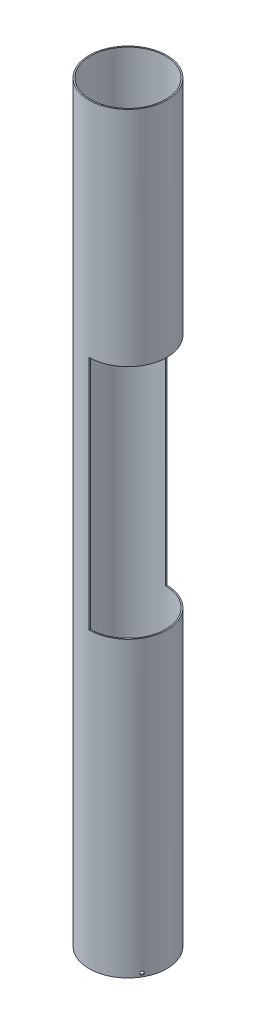
from build123d import *

# Parameters (mm, degrees)
SKETCH1_R           = 39.37
SKETCH1_R_2         = 38.1
BOSS_EXTRUDE1_DEPTH = 762
SKETCH2_R           = 1.692869147
CUT_EXTRUDE1_DEPTH  = 61.4
CIRPATTERN3_COUNT   = 3
SKETCH4_W           = 96.846889453
SKETCH4_H           = 239.152522935
CUT_EXTRUDE3_DEPTH  = 200


with BuildPart() as part:
    # Sketch1 → Boss-Extrude1 (new body)
    with BuildSketch(Plane(origin=(0, 0, 0), x_dir=(1, 0, 0), z_dir=(0, 1, 0))):
        with Locations(Location((0, 0, 0), (0, 0, 270))):
            Circle(SKETCH1_R)
        with Locations(Location((0, 0, 0), (0, 0, 270))):
            Circle(SKETCH1_R_2, mode=Mode.SUBTRACT)
    extrude(amount=BOSS_EXTRUDE1_DEPTH)

    # Sketch2 → Cut-Extrude1 (cut)
    with BuildSketch(Plane.XY):
        with Locations(Location((0, 3.287142885, 0), (0, 0, 90))):
            Circle(SKETCH2_R)
    cut_extrude1 = extrude(amount=-CUT_EXTRUDE1_DEPTH, mode=Mode.SUBTRACT)

    # CirPattern3: Cut-Extrude1 ×3 about axis
    cirpattern3_axis = Axis((0, 0, 0), (0, -1, 0))
    for i in range(1, CIRPATTERN3_COUNT):
        add(cut_extrude1.rotate(cirpattern3_axis, i * 360 / CIRPATTERN3_COUNT), mode=Mode.SUBTRACT)

    # Sketch4 → Cut-Extrude3 (cut)
    with BuildSketch(Plane(origin=(0, 0, 0), x_dir=(0, 0, -1), z_dir=(1, 0, 0))):
        with Locations((-1.346410096, 416.735952277)):
            Rectangle(SKETCH4_W, SKETCH4_H)
    extrude(amount=CUT_EXTRUDE3_DEPTH, mode=Mode.SUBTRACT)


solid = part.part
